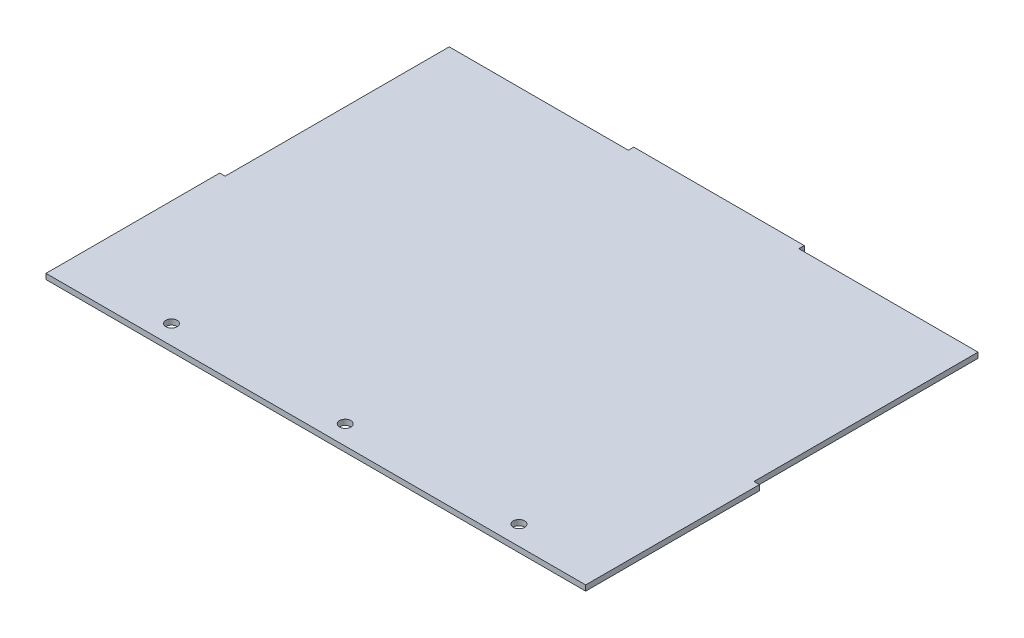
from build123d import *

# Parameters (mm, degrees)
SKETCH1_W           = 315.58
SKETCH1_H           = 3.175
BOSS_EXTRUDE1_DEPTH = 232.600000128
SKETCH5_W           = 3.175
SKETCH5_H           = 130.999992
CUT_EXTRUDE2_DEPTH  = 282.088108579
SKETCH7_R           = 3.302
CUT_EXTRUDE3_DEPTH  = 282.088108579
LPATTERN1_COUNT     = 3
LPATTERN1_PITCH     = 101.6
SKETCH8_W           = 99.68
SKETCH8_H           = 3.175
BOSS_EXTRUDE2_DEPTH = 3.175


with BuildPart() as part:
    # Sketch1 → Boss-Extrude1 (new body)
    with BuildSketch(Plane.XY):
        Rectangle(SKETCH1_W, SKETCH1_H)
    extrude(amount=BOSS_EXTRUDE1_DEPTH)

    # Sketch5 → Cut-Extrude2 (cut, symmetric)
    with BuildSketch(Plane(origin=(0, 1.5875, 0), x_dir=(1, 0, 0), z_dir=(0, 1, 0))):
        with Locations((-156.2025, -65.499996)):
            Rectangle(SKETCH5_W, SKETCH5_H)
    cut_extrude2 = extrude(amount=CUT_EXTRUDE2_DEPTH, both=True, mode=Mode.SUBTRACT)

    # Mirror1: Cut-Extrude2 across plane
    add(cut_extrude2.mirror(Plane(origin=(0, 0, 0), x_dir=(0, 0, 1), z_dir=(1, 0, 0))), mode=Mode.SUBTRACT)

    # Sketch7 → Cut-Extrude3 (cut, through all)
    with BuildSketch(Plane.XZ.offset(1.5875)):
        with Locations(Location((107.495393219, 221.30835, 0), (0, 0, 270))):
            Circle(SKETCH7_R)
    cut_extrude3 = extrude(amount=-CUT_EXTRUDE3_DEPTH, mode=Mode.SUBTRACT)

    # LPattern1: Cut-Extrude3 ×3
    with Locations(*[(-i * LPATTERN1_PITCH, 0, 0) for i in range(1, LPATTERN1_COUNT)]):
        add(cut_extrude3, mode=Mode.SUBTRACT)

    # Sketch8 → Boss-Extrude2 (add)
    with BuildSketch(Plane(origin=(0, 0, 0), x_dir=(-1, 0, 0), z_dir=(0, 0, -1))):
        Rectangle(SKETCH8_W, SKETCH8_H)
    extrude(amount=BOSS_EXTRUDE2_DEPTH)


solid = part.part
